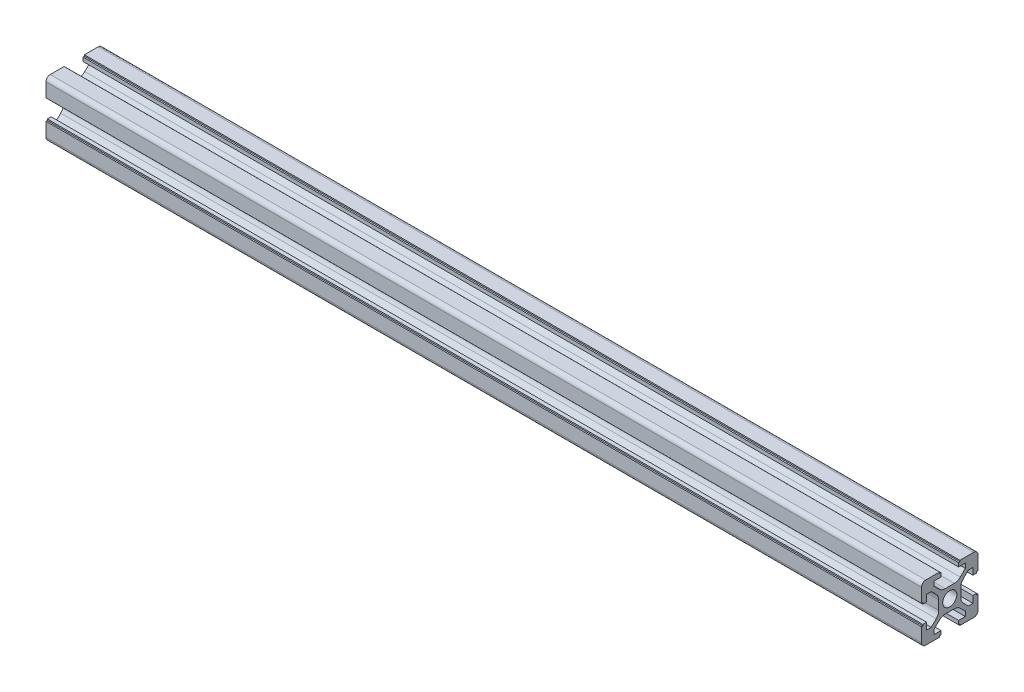
from build123d import *

# Parameters (mm, degrees)
EXTRUDE_1_DEPTH = 310
FILLET_1_R      = 1.5
FILLET_2_R      = 3


with BuildPart() as part:
    # 草图1 → 凸台-拉伸1 (new body)
    with BuildSketch(Plane(origin=(0, 0, 0), x_dir=(0, 0, -1), z_dir=(1, 0, 0))):
        Polygon((-10, 10), (-10, 3.6), (-9.530955747, 3.6), (-9.530955747, 3.1), (-8.2, 3.1), (-8.2, 5.5), (-6.560660172, 5.5), (-3.9, 2.839339828), (-3.9, 0), (-3.9, -2.839339828), (-6.560660172, -5.5), (-8.2, -5.5), (-8.2, -3.1), (-9.530955747, -3.1), (-9.530955747, -3.6), (-10, -3.6), (-10, -10), (-3.6, -10), (-3.6, -9.530955747), (-3.1, -9.530955747), (-3.1, -8.2), (-5.5, -8.2), (-5.5, -6.560660172), (-2.839339828, -3.9), (0, -3.9), (2.839339828, -3.9), (5.5, -6.560660172), (5.5, -8.2), (3.1, -8.2), (3.1, -9.530955747), (3.6, -9.530955747), (3.6, -10), (10, -10), (10, -3.6), (9.530955747, -3.6), (9.530955747, -3.1), (8.2, -3.1), (8.2, -5.5), (6.560660172, -5.5), (3.9, -2.839339828), (3.9, 0), (3.9, 2.839339828), (6.560660172, 5.5), (8.2, 5.5), (8.2, 3.1), (9.530955747, 3.1), (9.530955747, 3.6), (10, 3.6), (10, 10), (3.6, 10), (3.6, 9.530955747), (3.1, 9.530955747), (3.1, 8.2), (5.5, 8.2), (5.5, 6.560660172), (2.839339828, 3.9), (0, 3.9), (-2.839339828, 3.9), (-5.5, 6.560660172), (-5.5, 8.2), (-3.1, 8.2), (-3.1, 9.530955747), (-3.6, 9.530955747), (-3.6, 10), align=None)
        with BuildLine():
            ThreePointArc((0, 2.5), (-1.767766953, 1.767766953), (-2.5, 0))
            ThreePointArc((-2.5, 0), (-1.767766953, -1.767766953), (0, -2.5))
            ThreePointArc((0, -2.5), (1.767766953, -1.767766953), (2.5, 0))
            ThreePointArc((2.5, 0), (1.767766953, 1.767766953), (0, 2.5))
        make_face(mode=Mode.SUBTRACT)
    extrude(amount=EXTRUDE_1_DEPTH)

    # 圆角1
    fillet_1_edges = [part.edges().sort_by_distance(p)[0] for p in [
        (155, -10, -10),
        (155, -10, 10),
        (155, 10, 10),
        (155, 10, -10),
    ]]
    fillet(fillet_1_edges, radius=FILLET_1_R)

    # 圆角2
    fillet_2_edges = [part.edges().sort_by_distance(p)[0] for p in [
        (155, -3.9, -2.839339828),
        (155, -3.9, 2.839339828),
        (155, -2.839339828, 3.9),
        (155, 2.839339828, 3.9),
        (155, 3.9, 2.839339828),
        (155, 3.9, -2.839339828),
        (155, 2.839339828, -3.9),
        (155, -2.839339828, -3.9),
    ]]
    fillet(fillet_2_edges, radius=FILLET_2_R)


solid = part.part
